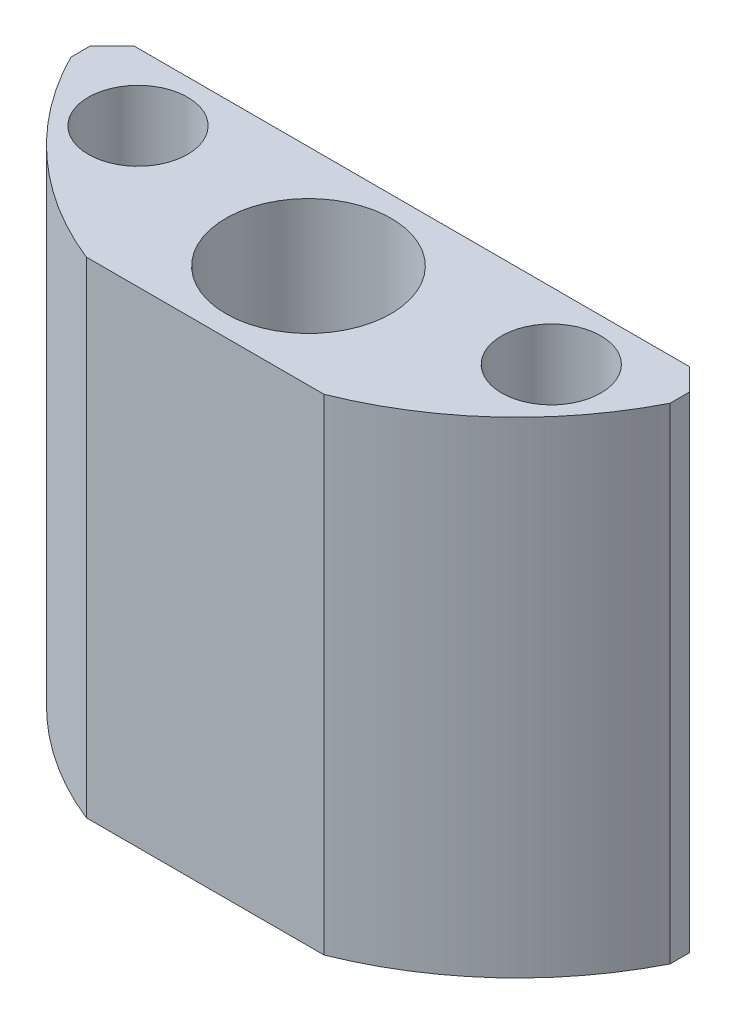
from build123d import *

# Parameters (mm, degrees)
BOSS_EXTRUDE1_DEPTH = 47
SKETCH2_R           = 4
SKETCH2_R_2         = 8
CUT_EXTRUDE1_DEPTH  = 59.736700622
SKETCH3_R           = 4.8
CUT_EXTRUDE2_DEPTH  = 37.5


with BuildPart() as part:
    # Sketch1 → Boss-Extrude1 (new body)
    with BuildSketch(Plane(origin=(0, 0, 0), x_dir=(1, 0, 0), z_dir=(0, 1, 0))):
        with BuildLine():
            Line((-26.878679656, 0), (26.878679656, 0))
            Line((26.878679656, 0), (29, -2.121320344))
            Line((29, -2.121320344), (29, -4))
            ThreePointArc((29, -4), (21.712972029, -13.600125657), (11.5, -20))
            Line((11.5, -20), (-11.5, -20))
            ThreePointArc((-11.5, -20), (-21.712972029, -13.600125657), (-29, -4))
            Line((-29, -4), (-29, -2.121320344))
            Line((-29, -2.121320344), (-26.878679656, 0))
        make_face()
    extrude(amount=-BOSS_EXTRUDE1_DEPTH)

    # Sketch2 → Cut-Extrude1 (cut, through all)
    with BuildSketch(Plane(origin=(0, 0, 0), x_dir=(1, 0, 0), z_dir=(0, 1, 0))):
        with Locations(Location((-20, -6.5, 0), (0, 0, 270))):
            Circle(SKETCH2_R)
        with Locations(Location((0, -10, 0), (0, 0, 270))):
            Circle(SKETCH2_R_2)
        with Locations(Location((20, -6.5, 0), (0, 0, 270))):
            Circle(SKETCH2_R)
    extrude(amount=-CUT_EXTRUDE1_DEPTH, mode=Mode.SUBTRACT)

    # Sketch3 → Cut-Extrude2 (cut)
    with BuildSketch(Plane(origin=(0, 0, 0), x_dir=(1, 0, 0), z_dir=(0, 1, 0))):
        with Locations(Location((-20, -6.5, 0), (0, 0, 270))):
            Circle(SKETCH3_R)
        with Locations(Location((20, -6.5, 0), (0, 0, 270))):
            Circle(SKETCH3_R)
    extrude(amount=-CUT_EXTRUDE2_DEPTH, mode=Mode.SUBTRACT)


solid = part.part
